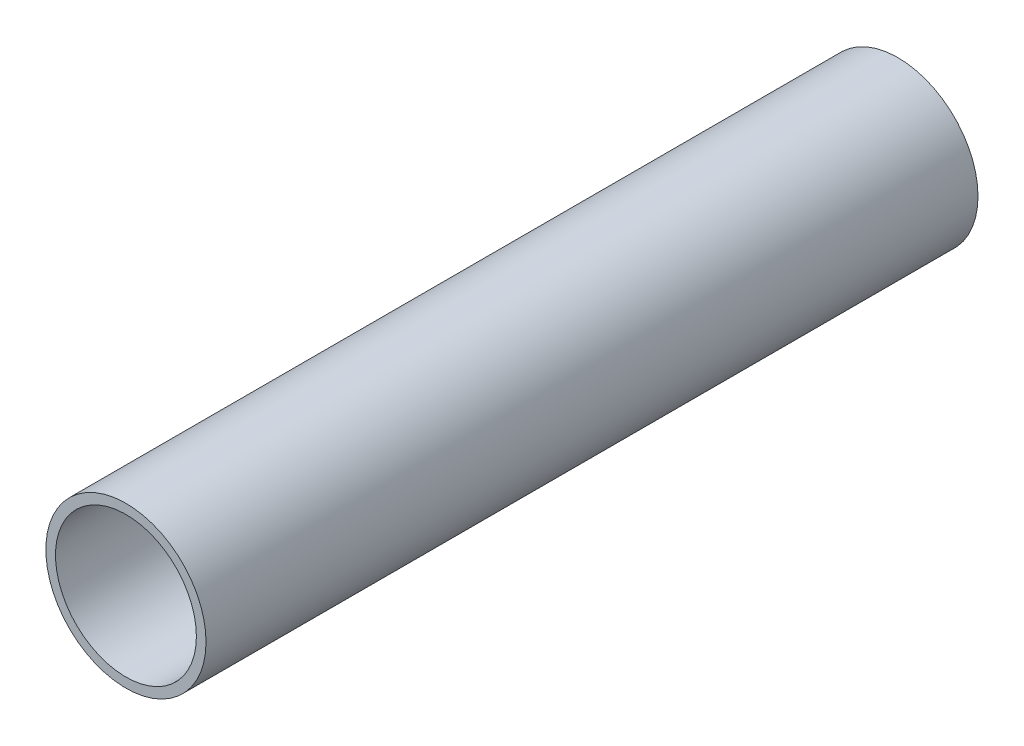
from build123d import *

# Parameters (mm, degrees)
SKETCH1_R           = 41.5
SKETCH1_R_2         = 36.5
BOSS_EXTRUDE1_DEPTH = 400


with BuildPart() as part:
    # Sketch1 → Boss-Extrude1 (new body)
    with BuildSketch(Plane.XY):
        Circle(SKETCH1_R)
        Circle(SKETCH1_R_2, mode=Mode.SUBTRACT)
    extrude(amount=BOSS_EXTRUDE1_DEPTH)


solid = part.part
